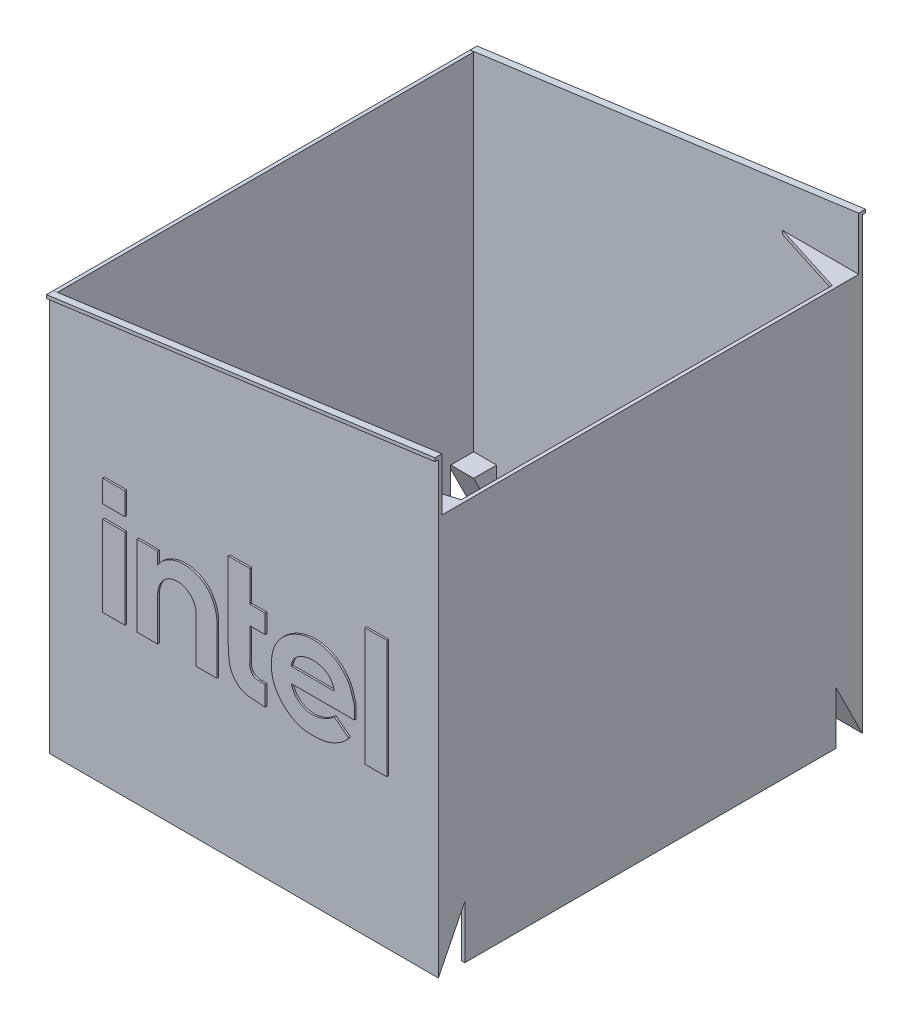
from build123d import *

# Parameters (mm, degrees)
SKETCH1_W             = 220
SKETCH1_H             = 240
SKETCH1_W_2           = 216
SKETCH1_H_2           = 236
EXTRUDE_THIN1_DEPTH   = 226
SKETCH2_W             = 15
SKETCH2_H             = 15
CUT_EXTRUDE1_DEPTH    = 5
BOSS_EXTRUDE2_DEPTH   = 2
BOSS_EXTRUDE3_DEPTH   = 2
BOSS_EXTRUDE4_DEPTH   = 1.89
BOSS_EXTRUDE5_DEPTH   = 1.89
BOSS_EXTRUDE6_DEPTH   = 1
SKETCH10_W            = 12.64
SKETCH10_H            = 12.64
BOSS_EXTRUDE6_2_DEPTH = 1
SKETCH10_H_2          = 45.640137025
BOSS_EXTRUDE6_3_DEPTH = 1
BOSS_EXTRUDE6_4_DEPTH = 1
BOSS_EXTRUDE6_5_DEPTH = 1
SKETCH10_W_2          = 12.35434891
SKETCH10_H_3          = 66.897035183
BOSS_EXTRUDE6_6_DEPTH = 1
SKETCH14_W            = 12.64
SKETCH14_H            = 12.64
SKETCH14_H_2          = 45.640137025
SKETCH14_W_2          = 12.35434891
SKETCH14_H_3          = 66.897035183
BOSS_EXTRUDE7_DEPTH   = 1
SKETCH4_W             = 15
SKETCH4_H             = 15
CUT_EXTRUDE2_DEPTH    = 25
BOSS_EXTRUDE8_DEPTH   = 15
BOSS_EXTRUDE9_DEPTH   = 15
BOSS_EXTRUDE10_DEPTH  = 2


with BuildPart() as part:
    # Sketch1 → Extrude-Thin1 (new body)
    with BuildSketch(Plane(origin=(0, 0, 0), x_dir=(1, 0, 0), z_dir=(0, 1, 0))):
        Rectangle(SKETCH1_W, SKETCH1_H)
        Rectangle(SKETCH1_W_2, SKETCH1_H_2, mode=Mode.SUBTRACT)
    extrude(amount=EXTRUDE_THIN1_DEPTH)

    # Sketch2 → Cut-Extrude1 (cut)
    with BuildSketch(Plane.XZ):
        with Locations((-102.5, 112.5)):
            Rectangle(SKETCH2_W, SKETCH2_H)
        with Locations((102.5, 112.5)):
            Rectangle(SKETCH2_W, SKETCH2_H)
        with Locations((-102.5, -112.5)):
            Rectangle(SKETCH2_W, SKETCH2_H)
        with Locations((102.5, -112.5)):
            Rectangle(SKETCH2_W, SKETCH2_H)
    extrude(amount=-CUT_EXTRUDE1_DEPTH, mode=Mode.SUBTRACT)

    # Sketch6 → Boss-Extrude2 (add)
    with BuildSketch(Plane(origin=(0, 0, -120), x_dir=(-1, 0, 0), z_dir=(0, 0, -1))):
        Polygon((110, 226), (-110, 226), (-110, 256), align=None)
    extrude(amount=-BOSS_EXTRUDE2_DEPTH)

    # Sketch7 → Boss-Extrude3 (add)
    with BuildSketch(Plane.XY.offset(120)):
        Polygon((110, 226), (110, 256), (-110, 226), align=None)
    extrude(amount=-BOSS_EXTRUDE3_DEPTH)

    # Sketch8 → Boss-Extrude4 (add)
    with BuildSketch(Plane.XY.offset(120)):
        Polygon((-110, 226), (110, 256), (110, 254.11), (-110, 224.11), align=None)
    extrude(amount=BOSS_EXTRUDE4_DEPTH)

    # Sketch9 → Boss-Extrude5 (add)
    with BuildSketch(Plane(origin=(0, 0, -120), x_dir=(-1, 0, 0), z_dir=(0, 0, -1))):
        Polygon((-110, 256), (-110, 254.11), (110, 224.11), (110, 226), align=None)
    extrude(amount=BOSS_EXTRUDE5_DEPTH)

    # Sketch14 → Boss-Extrude7 (add)
    # profile 1 of 6: a face of its own
    with BuildSketch(Plane.XY.offset(120)):
        with BuildLine():
            Line((-14.375501848, 110.505781658), (-14.375501848, 85.247943004))
            Line((-14.375501848, 85.247943004), (-26.184876668, 85.247943004))
            Line((-26.184876668, 85.247943004), (-26.184876668, 111.462438893))
            add(Edge.make_bspline(
                [(-26.184876668, 111.462438893), (-26.176751947, 115.406902185), (-31.318461772, 122.727777409), (-44.454911836, 121.164108407), (-47.670889897, 113.60907603), (-47.896720024, 109.997283131)],
                knots=[0, 0, 0, 0, 0.356222685, 0.66540074, 1, 1, 1, 1], degree=3))
            Line((-47.896720024, 109.997283131), (-47.896720024, 85.247943004))
            Line((-47.896720024, 85.247943004), (-59.57834772, 85.247943004))
            Line((-59.57834772, 85.247943004), (-59.57834772, 130.888080029))
            Line((-59.57834772, 130.888080029), (-47.896720024, 130.888080029))
            Line((-47.896720024, 130.888080029), (-47.896720024, 123.88380311))
            add(Edge.make_bspline(
                [(-47.896720024, 123.88380311), (-46.700945698, 126.273534181), (-42.981339417, 129.402795669), (-35.50270975, 132.306145278), (-27.620274891, 131.678287803), (-16.830799959, 126.224260175), (-13.925226686, 116.501352038), (-14.375501848, 110.505781658)],
                knots=[0, 0, 0, 0, 0.159974343, 0.285001761, 0.480268441, 0.619535919, 1, 1, 1, 1], degree=3))
        make_face()
    # profile 2 of 6: a face of its own
    with BuildSketch(Plane.XY.offset(120)):
        with Locations((-72.727719867, 144.762169781)):
            Rectangle(SKETCH14_W, SKETCH14_H)
    # profile 3 of 6: a face of its own
    with BuildSketch(Plane.XY.offset(120)):
        with Locations((-72.727719867, 108.068011517)):
            Rectangle(SKETCH14_W, SKETCH14_H_2)
    # profile 4 of 6: a face of its own
    with BuildSketch(Plane.XY.offset(120)):
        with BuildLine():
            Line((4.244826487, 102.203557412), (4.244826487, 120.299227281))
            Line((4.244826487, 120.299227281), (12.954499457, 120.299227281))
            Line((12.954499457, 120.299227281), (12.954499457, 130.888080029))
            Line((12.954499457, 130.888080029), (4.244826487, 130.888080029))
            Line((4.244826487, 130.888080029), (4.244826487, 148.446671498))
            Line((4.244826487, 148.446671498), (-7.944362148, 148.446671498))
            Line((-7.944362148, 148.446671498), (-7.944362148, 104.574864724))
            add(Edge.make_bspline(
                [(-7.944362148, 104.574864724), (-7.780046473, 100.890399735), (-7.77816697, 95.57528213), (-4.319962519, 89.334346995), (-0.009810659, 85.903156627), (4.071219063, 85.254294675), (6.048923419, 85.247943004)],
                knots=[0, 0, 0, 0, 0.419621674, 0.554669316, 0.780328407, 1, 1, 1, 1], degree=3))
            Line((6.048923419, 85.247943004), (12.954499457, 84.743157177))
            Line((12.954499457, 84.743157177), (12.954499457, 95.960818351))
            Line((12.954499457, 95.960818351), (10.045628277, 95.960818351))
            add(Edge.make_bspline(
                [(10.045628277, 95.960818351), (8.724106043, 95.863617006), (6.417122941, 96.198672747), (4.475272282, 98.986269458), (4.064037692, 100.904595701), (4.244826487, 102.203557412)],
                knots=[0, 0, 0, 0, 0.42467298, 0.607236149, 1, 1, 1, 1], degree=3))
        make_face()
    # profile 5 of 6: a face of its own
    with BuildSketch(Plane.XY.offset(120)):
        with BuildLine():
            Line((51.994675312, 99.630407614), (60.251934056, 93.351411767))
            add(Edge.make_bspline(
                [(60.251934056, 93.351411767), (58.766721904, 90.95869423), (54.690003587, 87.926928165), (47.624153652, 84.665513043), (40.179980895, 84.21015646), (31.923394214, 84.775943368), (24.200055293, 89.416048463), (17.128224377, 97.863335085), (15.66175202, 109.318239336), (19.691585938, 123.057283624), (32.985169904, 132.459677371), (50.314567813, 131.313647062), (60.709438455, 121.915543005), (62.534266958, 114.208946177), (63.182456193, 111.807416364)],
                knots=[0, 0, 0, 0, 0.064712614, 0.115490509, 0.178952232, 0.235791468, 0.305170214, 0.381715203, 0.485058955, 0.557907811, 0.707956804, 0.817891408, 0.942015113, 1, 1, 1, 1], degree=3))
            add(Edge.make_bspline(
                [(63.182456193, 111.807416364), (63.54649658, 110.710454076), (63.416259573, 107.991577908), (63.522174272, 105.291917887), (63.479008251, 103.70671186)],
                knots=[0, 0, 0, 0, 0.415978264, 1, 1, 1, 1], degree=3))
            Line((63.479008251, 103.70671186), (27.787885871, 103.70671186))
            add(Edge.make_bspline(
                [(27.787885871, 103.70671186), (29.182849555, 98.269445997), (33.974081235, 94.774971314), (43.048790111, 94.10539305), (49.219782096, 96.850472758), (51.994675312, 99.630407614)],
                knots=[0, 0, 0, 0, 0.510514061, 0.610514061, 1, 1, 1, 1], degree=3))
        make_face()
        with BuildLine():
            Line((51.994675312, 112.227907921), (27.787885871, 112.227907921))
            add(Edge.make_bspline(
                [(27.787885871, 112.227907921), (27.927718411, 113.66702185), (28.808582522, 116.684571882), (32.293563775, 119.606055097), (36.17258621, 120.951433435), (40.02475165, 121.435573743), (44.1120555, 121.027546841), (49.284976415, 118.733644619), (51.759130291, 114.941063807), (51.994675312, 112.227907921)],
                knots=[0, 0, 0, 0, 0.131813419, 0.272597163, 0.391908136, 0.500589712, 0.621730083, 0.759761882, 1, 1, 1, 1], degree=3))
        make_face(mode=Mode.SUBTRACT)
    # profile 6 of 6: a face of its own
    with BuildSketch(Plane.XY.offset(120)):
        with Locations((75.637802206, 118.508035979)):
            Rectangle(SKETCH14_W_2, SKETCH14_H_3)
    extrude(amount=BOSS_EXTRUDE7_DEPTH)

    # Sketch4 → Cut-Extrude2 (cut)
    with BuildSketch(Plane.XZ.offset(-5)):
        with Locations((102.5, 112.5)):
            Rectangle(SKETCH4_W, SKETCH4_H)
        with Locations((-102.5, 112.5)):
            Rectangle(SKETCH4_W, SKETCH4_H)
        with Locations((-102.5, -112.5)):
            Rectangle(SKETCH4_W, SKETCH4_H)
        with Locations((102.5, -112.5)):
            Rectangle(SKETCH4_W, SKETCH4_H)
    extrude(amount=-CUT_EXTRUDE2_DEPTH, mode=Mode.SUBTRACT)

    # Sketch15 → Boss-Extrude8 (add)
    with BuildSketch(Plane(origin=(110, 0, 0), x_dir=(0, 0, -1), z_dir=(1, 0, 0))):
        Polygon((120, 30), (120, 0), (105, 30), align=None)
        Polygon((-120, 30), (-105, 30), (-120, 0), align=None)
    extrude(amount=-BOSS_EXTRUDE8_DEPTH)

    # Sketch16 → Boss-Extrude9 (add)
    with BuildSketch(Plane.ZY.offset(110)):
        Polygon((105, 30), (120, 30), (120, 0), align=None)
        Polygon((-120, 30), (-120, 0), (-105, 30), align=None)
    extrude(amount=-BOSS_EXTRUDE9_DEPTH)

    # Sketch19 → Boss-Extrude10 (add)
    with BuildSketch(Plane(origin=(0, 226, 0), x_dir=(1, 0, 0), z_dir=(0, 1, 0))):
        Polygon((108, 105), (66.821371219, 118), (108, 118), align=None)
        Polygon((108, -105), (66.821371219, -118), (108, -118), align=None)
    extrude(amount=-BOSS_EXTRUDE10_DEPTH)


with BuildPart() as body_2:
    # Sketch10 → Boss-Extrude6 (new body)
    with BuildSketch(Plane(origin=(0, 0, -120), x_dir=(-1, 0, 0), z_dir=(0, 0, -1))):
        with BuildLine():
            Line((-18.096521808, 106.099464761), (-18.096521808, 80.841626108))
            Line((-18.096521808, 80.841626108), (-29.905896628, 80.841626108))
            Line((-29.905896628, 80.841626108), (-29.905896628, 107.056121997))
            add(Edge.make_bspline(
                [(-29.905896628, 107.056121997), (-29.897771907, 111.000585289), (-35.039481732, 118.321460513), (-48.175931796, 116.757791511), (-51.391909857, 109.202759134), (-51.617739984, 105.590966235)],
                knots=[0, 0, 0, 0, 0.356222685, 0.66540074, 1, 1, 1, 1], degree=3))
            Line((-51.617739984, 105.590966235), (-51.617739984, 80.841626108))
            Line((-51.617739984, 80.841626108), (-63.29936768, 80.841626108))
            Line((-63.29936768, 80.841626108), (-63.29936768, 126.481763133))
            Line((-63.29936768, 126.481763133), (-51.617739984, 126.481763133))
            Line((-51.617739984, 126.481763133), (-51.617739984, 119.477486214))
            add(Edge.make_bspline(
                [(-51.617739984, 119.477486214), (-50.421965657, 121.867217285), (-46.702359377, 124.996478773), (-39.22372971, 127.899828382), (-31.341294851, 127.271970907), (-20.551819919, 121.817943279), (-17.646246646, 112.095035142), (-18.096521808, 106.099464761)],
                knots=[0, 0, 0, 0, 0.159974343, 0.285001761, 0.480268441, 0.619535919, 1, 1, 1, 1], degree=3))
        make_face()
    extrude(amount=BOSS_EXTRUDE6_DEPTH)


with BuildPart() as body_3:
    # Sketch10 → Boss-Extrude6 2 (new body)
    with BuildSketch(Plane(origin=(0, 0, -120), x_dir=(-1, 0, 0), z_dir=(0, 0, -1))):
        with Locations((-76.448739827, 140.355852885)):
            Rectangle(SKETCH10_W, SKETCH10_H)
    extrude(amount=BOSS_EXTRUDE6_2_DEPTH)


with BuildPart() as body_4:
    # Sketch10 → Boss-Extrude6 3 (new body)
    with BuildSketch(Plane(origin=(0, 0, -120), x_dir=(-1, 0, 0), z_dir=(0, 0, -1))):
        with Locations((-76.448739827, 103.661694621)):
            Rectangle(SKETCH10_W, SKETCH10_H_2)
    extrude(amount=BOSS_EXTRUDE6_3_DEPTH)


with BuildPart() as body_5:
    # Sketch10 → Boss-Extrude6 4 (new body)
    with BuildSketch(Plane(origin=(0, 0, -120), x_dir=(-1, 0, 0), z_dir=(0, 0, -1))):
        with BuildLine():
            Line((0.523806528, 97.797240516), (0.523806528, 115.892910385))
            Line((0.523806528, 115.892910385), (9.233479497, 115.892910385))
            Line((9.233479497, 115.892910385), (9.233479497, 126.481763133))
            Line((9.233479497, 126.481763133), (0.523806528, 126.481763133))
            Line((0.523806528, 126.481763133), (0.523806528, 144.040354602))
            Line((0.523806528, 144.040354602), (-11.665382108, 144.040354602))
            Line((-11.665382108, 144.040354602), (-11.665382108, 100.168547828))
            add(Edge.make_bspline(
                [(-11.665382108, 100.168547828), (-11.501066433, 96.484082839), (-11.499186929, 91.168965234), (-8.040982479, 84.928030099), (-3.730830619, 81.496839731), (0.350199104, 80.847977779), (2.32790346, 80.841626108)],
                knots=[0, 0, 0, 0, 0.419621674, 0.554669316, 0.780328407, 1, 1, 1, 1], degree=3))
            Line((2.32790346, 80.841626108), (9.233479497, 80.336840281))
            Line((9.233479497, 80.336840281), (9.233479497, 91.554501455))
            Line((9.233479497, 91.554501455), (6.324608317, 91.554501455))
            add(Edge.make_bspline(
                [(6.324608317, 91.554501455), (5.003086083, 91.45730011), (2.696102981, 91.792355851), (0.754252322, 94.579952562), (0.343017732, 96.498278805), (0.523806528, 97.797240516)],
                knots=[0, 0, 0, 0, 0.42467298, 0.607236149, 1, 1, 1, 1], degree=3))
        make_face()
    extrude(amount=BOSS_EXTRUDE6_4_DEPTH)


with BuildPart() as body_6:
    # Sketch10 → Boss-Extrude6 5 (new body)
    with BuildSketch(Plane(origin=(0, 0, -120), x_dir=(-1, 0, 0), z_dir=(0, 0, -1))):
        with BuildLine():
            Line((48.273655352, 95.224090718), (56.530914097, 88.945094871))
            add(Edge.make_bspline(
                [(56.530914097, 88.945094871), (55.045701944, 86.552377334), (50.968983627, 83.520611269), (43.903133692, 80.259196147), (36.458960935, 79.803839564), (28.202374254, 80.369626472), (20.479035334, 85.009731567), (13.407204418, 93.457018189), (11.94073206, 104.91192244), (15.970565978, 118.650966728), (29.264149945, 128.053360475), (46.593547853, 126.907330166), (56.988418495, 117.509226109), (58.813246998, 109.802629281), (59.461436234, 107.401099468)],
                knots=[0, 0, 0, 0, 0.064712614, 0.115490509, 0.178952232, 0.235791468, 0.305170214, 0.381715203, 0.485058955, 0.557907811, 0.707956804, 0.817891408, 0.942015113, 1, 1, 1, 1], degree=3))
            add(Edge.make_bspline(
                [(59.461436234, 107.401099468), (59.82547662, 106.30413718), (59.695239614, 103.585261012), (59.801154312, 100.885600991), (59.757988291, 99.300394964)],
                knots=[0, 0, 0, 0, 0.415978264, 1, 1, 1, 1], degree=3))
            Line((59.757988291, 99.300394964), (24.066865911, 99.300394964))
            add(Edge.make_bspline(
                [(24.066865911, 99.300394964), (25.461829595, 93.863129101), (30.253061276, 90.368654418), (39.327770151, 89.699076154), (45.498762137, 92.444155862), (48.273655352, 95.224090718)],
                knots=[0, 0, 0, 0, 0.510514061, 0.610514061, 1, 1, 1, 1], degree=3))
        make_face()
        with BuildLine():
            Line((48.273655352, 107.821591025), (24.066865911, 107.821591025))
            add(Edge.make_bspline(
                [(24.066865911, 107.821591025), (24.206698451, 109.260704954), (25.087562562, 112.278254986), (28.572543815, 115.199738201), (32.45156625, 116.545116539), (36.303731691, 117.029256847), (40.39103554, 116.621229945), (45.563956456, 114.327327723), (48.038110331, 110.534746911), (48.273655352, 107.821591025)],
                knots=[0, 0, 0, 0, 0.131813419, 0.272597163, 0.391908136, 0.500589712, 0.621730083, 0.759761882, 1, 1, 1, 1], degree=3))
        make_face(mode=Mode.SUBTRACT)
    extrude(amount=BOSS_EXTRUDE6_5_DEPTH)


with BuildPart() as body_7:
    # Sketch10 → Boss-Extrude6 6 (new body)
    with BuildSketch(Plane(origin=(0, 0, -120), x_dir=(-1, 0, 0), z_dir=(0, 0, -1))):
        with Locations((71.916782246, 114.101719083)):
            Rectangle(SKETCH10_W_2, SKETCH10_H_3)
    extrude(amount=BOSS_EXTRUDE6_6_DEPTH)


solid = Compound([part.part, body_2.part, body_3.part, body_4.part, body_5.part, body_6.part, body_7.part])
